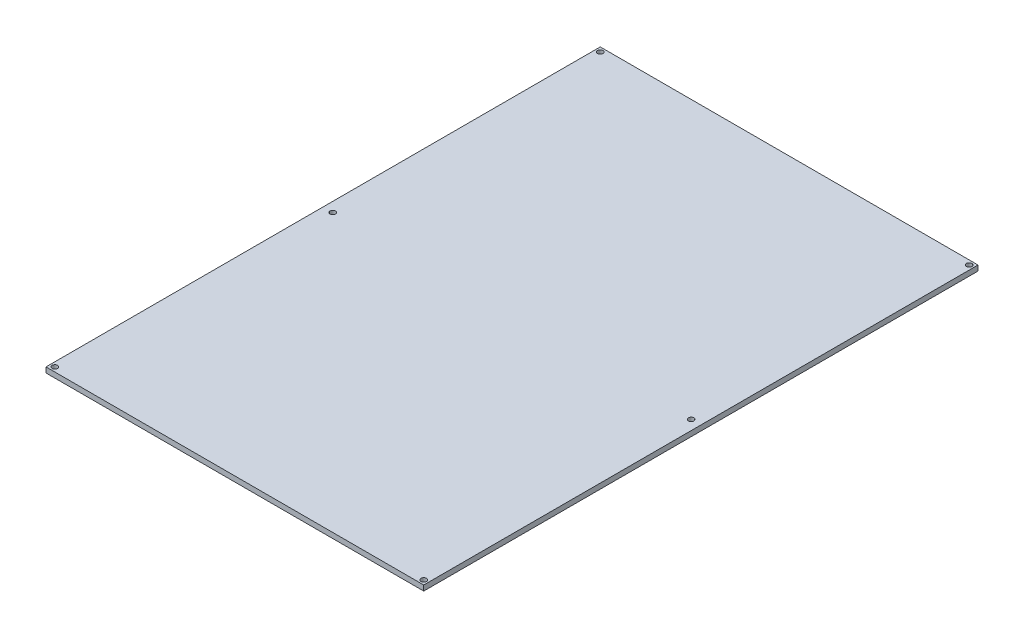
from build123d import *

# Parameters (mm, degrees)
CROQUIS1_W              = 214
CROQUIS1_H              = 314
CROQUIS1_R              = 1.55
SALIENTE_EXTRUIR1_DEPTH = 3


with BuildPart() as part:
    # Croquis1 → Saliente-Extruir1 (new body)
    with BuildSketch(Plane(origin=(0, 0, 0), x_dir=(1, 0, 0), z_dir=(0, 1, 0))):
        with Locations((107, 157)):
            Rectangle(CROQUIS1_W, CROQUIS1_H)
        with Locations(Location((2.5, 311.5, 0), (0, 0, 270))):
            Circle(CROQUIS1_R, mode=Mode.SUBTRACT)
        with Locations(Location((211.5, 311.5, 0), (0, 0, 90))):
            Circle(CROQUIS1_R, mode=Mode.SUBTRACT)
        with Locations(Location((2.5, 2.5, 0), (0, 0, 90))):
            Circle(CROQUIS1_R, mode=Mode.SUBTRACT)
        with Locations(Location((211.5, 2.5, 0), (0, 0, 270))):
            Circle(CROQUIS1_R, mode=Mode.SUBTRACT)
        with Locations(Location((5.5, 157, 0), (0, 0, 270))):
            Circle(CROQUIS1_R, mode=Mode.SUBTRACT)
        with Locations(Location((208.5, 157, 0), (0, 0, 90))):
            Circle(CROQUIS1_R, mode=Mode.SUBTRACT)
    extrude(amount=SALIENTE_EXTRUIR1_DEPTH)


solid = part.part
